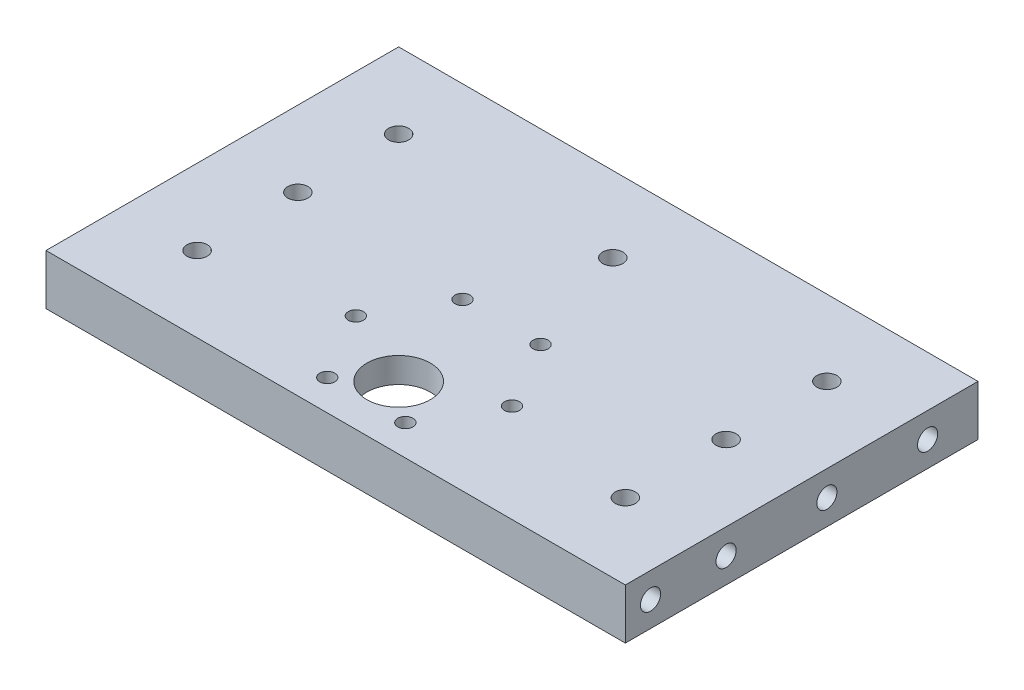
from build123d import *

# Parameters (mm, degrees)
SKETCH1_W           = 115
SKETCH1_H           = 70
BOSS_EXTRUDE1_DEPTH = 10
SKETCH2_R           = 6.3
SKETCH2_R_2         = 1.5
CUT_EXTRUDE1_DEPTH  = 10
SKETCH3_R           = 18.5
CUT_EXTRUDE2_DEPTH  = 5
SKETCH4_R           = 2
CUT_EXTRUDE3_DEPTH  = 10
CUT_EXTRUDE4_START  = -10
SKETCH5_R           = 2
CUT_EXTRUDE4_DEPTH  = 10
SKETCH6_R           = 2
CUT_EXTRUDE5_DEPTH  = 5
SKETCH7_R           = 2
CUT_EXTRUDE6_DEPTH  = 10


with BuildPart() as part:
    # Sketch1 → Boss-Extrude1 (new body)
    with BuildSketch(Plane(origin=(0, 0, 0), x_dir=(1, 0, 0), z_dir=(0, 1, 0))):
        Rectangle(SKETCH1_W, SKETCH1_H)
    extrude(amount=BOSS_EXTRUDE1_DEPTH)

    # Sketch2 → Cut-Extrude1 (cut)
    with BuildSketch(Plane(origin=(0, 10, 0), x_dir=(1, 0, 0), z_dir=(0, 1, 0))):
        with Locations(Location((0, -22.5, 0), (0, 0, 270))):
            Circle(SKETCH2_R)
        with Locations(Location((15.5, -15.5, 0), (0, 0, 270))):
            Circle(SKETCH2_R_2)
        with Locations(Location((7.75, -28.923393759, 0), (0, 0, 270))):
            Circle(SKETCH2_R_2)
        with Locations(Location((-7.75, -28.923393759, 0), (0, 0, 270))):
            Circle(SKETCH2_R_2)
        with Locations(Location((-15.5, -15.5, 0), (0, 0, 270))):
            Circle(SKETCH2_R_2)
        with Locations(Location((-7.75, -2.076606241, 0), (0, 0, 270))):
            Circle(SKETCH2_R_2)
        with Locations(Location((7.75, -2.076606241, 0), (0, 0, 270))):
            Circle(SKETCH2_R_2)
    extrude(amount=-CUT_EXTRUDE1_DEPTH, mode=Mode.SUBTRACT)

    # Sketch3 → Cut-Extrude2 (cut)
    with BuildSketch(Plane.XZ):
        with Locations(Location((0, 15.5, 0), (0, 0, 270))):
            Circle(SKETCH3_R)
    extrude(amount=-CUT_EXTRUDE2_DEPTH, mode=Mode.SUBTRACT)

    # Sketch4 → Cut-Extrude3 (cut)
    with BuildSketch(Plane.ZY.offset(57.5)):
        with Locations((30, 5)):
            Circle(SKETCH4_R)
        with Locations((15, 5)):
            Circle(SKETCH4_R)
        with Locations((-5, 5)):
            Circle(SKETCH4_R)
        with Locations((-25, 5)):
            Circle(SKETCH4_R)
    extrude(amount=-CUT_EXTRUDE3_DEPTH, mode=Mode.SUBTRACT)

    # Sketch5 → Cut-Extrude4 (cut)
    with BuildSketch(Plane(origin=(57.5, 0, 0), x_dir=(0, 0, -1), z_dir=(1, 0, 0)).offset(CUT_EXTRUDE4_START)):
        with Locations(Location((-30, 5, 0), (0, 0, 180))):
            Circle(SKETCH5_R)
        with Locations(Location((-15, 5, 0), (0, 0, 180))):
            Circle(SKETCH5_R)
        with Locations(Location((5, 5, 0), (0, 0, 180))):
            Circle(SKETCH5_R)
        with Locations(Location((25, 5, 0), (0, 0, 180))):
            Circle(SKETCH5_R)
    extrude(amount=CUT_EXTRUDE4_DEPTH, mode=Mode.SUBTRACT)

    # Sketch6 → Cut-Extrude5 (cut)
    with BuildSketch(Plane(origin=(0, 0, -35), x_dir=(-1, 0, 0), z_dir=(0, 0, -1))):
        with Locations((-52.5, 5)):
            Circle(SKETCH6_R)
        with Locations((52.5, 5)):
            Circle(SKETCH6_R)
    extrude(amount=-CUT_EXTRUDE5_DEPTH, mode=Mode.SUBTRACT)

    # Sketch7 → Cut-Extrude6 (cut)
    with BuildSketch(Plane.XZ):
        with Locations(Location((42.5, 20, 0), (0, 0, 270))):
            Circle(SKETCH7_R)
        with Locations(Location((42.5, 0, 0), (0, 0, 270))):
            Circle(SKETCH7_R)
        with Locations(Location((42.5, -20, 0), (0, 0, 270))):
            Circle(SKETCH7_R)
        with Locations(Location((-42.5, -20, 0), (0, 0, 270))):
            Circle(SKETCH7_R)
        with Locations(Location((-42.5, 0, 0), (0, 0, 270))):
            Circle(SKETCH7_R)
        with Locations(Location((-42.5, 20, 0), (0, 0, 270))):
            Circle(SKETCH7_R)
        with Locations(Location((0, -20, 0), (0, 0, 270))):
            Circle(SKETCH7_R)
    extrude(amount=-CUT_EXTRUDE6_DEPTH, mode=Mode.SUBTRACT)


solid = part.part
